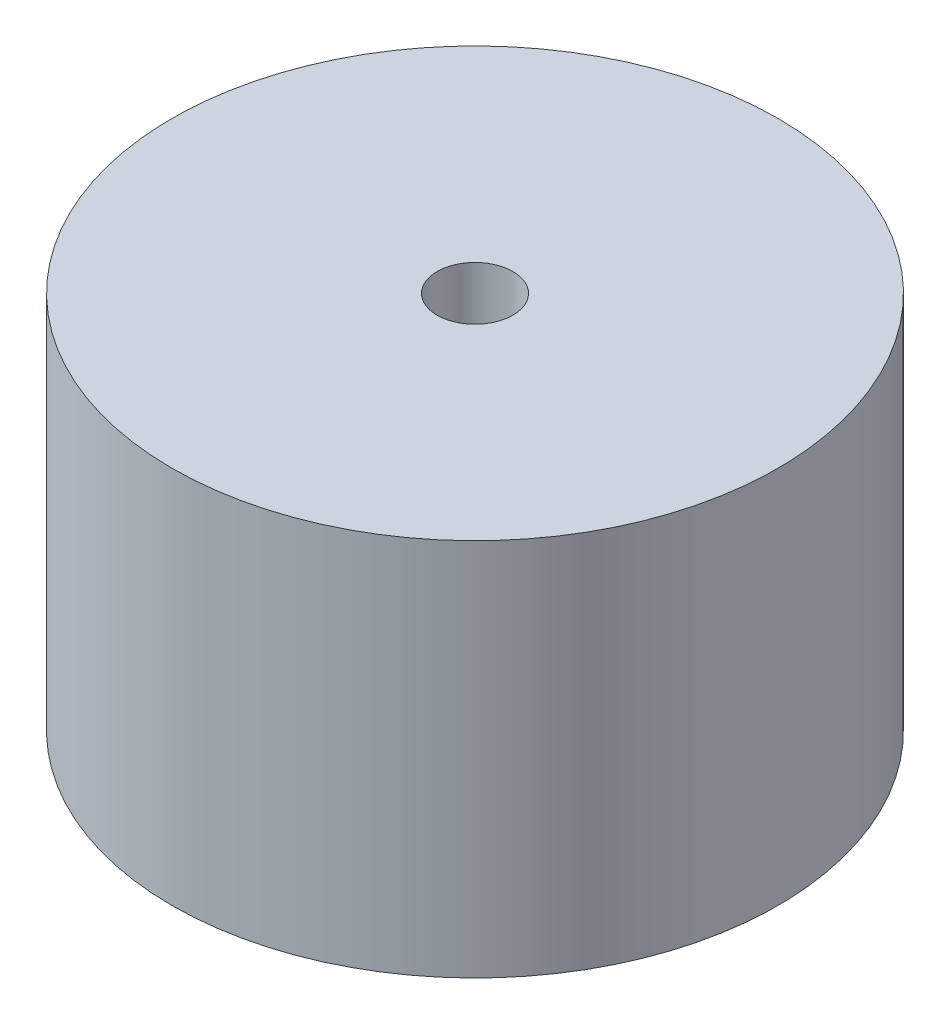
from build123d import *

# Parameters (mm, degrees)
SKETCH_1_R      = 40
SKETCH_1_R_2    = 5
EXTRUDE_1_DEPTH = 50


with BuildPart() as part:
    # 草图1 → 凸台-拉伸1 (new body)
    with BuildSketch(Plane(origin=(0, 0, 0), x_dir=(1, 0, 0), z_dir=(0, 1, 0))):
        with Locations(Location((0, 0, 0), (0, 0, 270))):
            Circle(SKETCH_1_R)
        with Locations(Location((0, 0, 0), (0, 0, 270))):
            Circle(SKETCH_1_R_2, mode=Mode.SUBTRACT)
    extrude(amount=EXTRUDE_1_DEPTH)


solid = part.part
